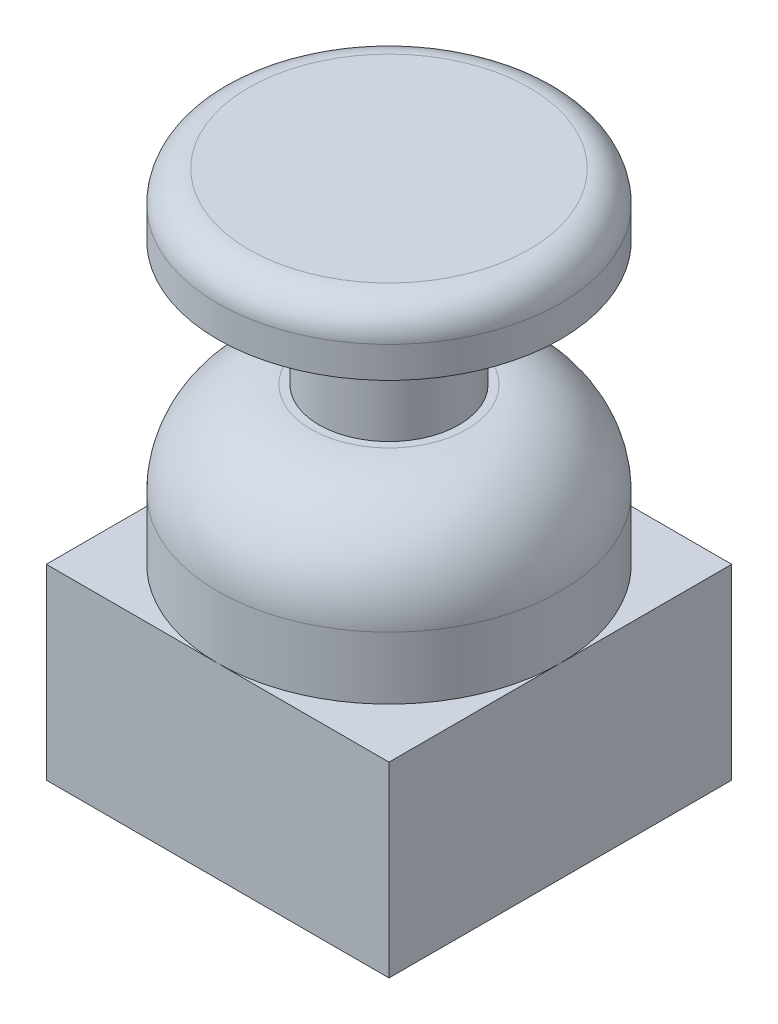
from build123d import *

# Parameters (mm, degrees)
SKETCH2_W           = 22
SKETCH2_H           = 22
BOSS_EXTRUDE1_DEPTH = 12


with BuildPart() as part:
    # Sketch1 → Revolve1 (revolve)
    with BuildSketch(Plane.XY, mode=Mode.PRIVATE) as revolve1_sk:
        with BuildLine():
            Line((0, 0), (-11, 0))
            Line((-11, 0), (-11, 16))
            ThreePointArc((-11, 16), (-9.242640687, 20.242640687), (-5, 22))
            Line((-5, 22), (-4.5, 22))
            Line((-4.5, 22), (-4.5, 30))
            Line((-4.5, 30), (-11, 30))
            Line((-11, 30), (-11, 32))
            ThreePointArc((-11, 32), (-10.414213562, 33.414213562), (-9, 34))
            Line((-9, 34), (0, 34))
            Line((0, 34), (0, 0))
        make_face()
    revolve(revolve1_sk.sketch.rotate(Axis((0, 34, 0), (0, -1, 0)), 270), axis=Axis((0, 34, 0), (0, -1, 0)))

    # Sketch2 → Boss-Extrude1 (add)
    with BuildSketch(Plane.XZ):
        Rectangle(SKETCH2_W, SKETCH2_H)
    extrude(amount=-BOSS_EXTRUDE1_DEPTH)


solid = part.part
